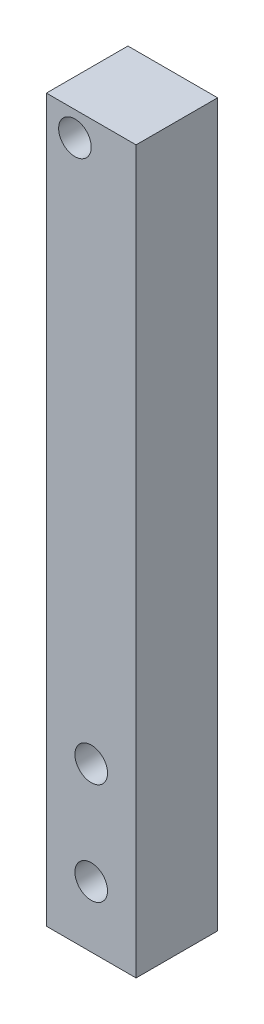
from build123d import *

# Parameters (mm, degrees)
SKETCH_4_R          = 4
EXTRUDE_3_DEPTH     = 20
CUT_EXTRUDE_1_REACH = 174.818
SKETCH_5_R          = 4


with BuildPart() as part:
    # 草图4 → 凸台-拉伸3 (new body)
    with BuildSketch(Plane.XY):
        Polygon((-7, 6), (15, 6), (15, -6), (15, -171), (-7, -171), (-7, -6), align=None)
        Circle(SKETCH_4_R, mode=Mode.SUBTRACT)
    extrude(amount=EXTRUDE_3_DEPTH)

    # 草图5 → 切除-拉伸1 (cut, up to next)
    with BuildSketch(Plane.XY.offset(20), mode=Mode.PRIVATE) as cut_extrude_1_sk1:
        with Locations((4, -131)):
            Circle(SKETCH_5_R)
    cut_extrude_1_tool1 = extrude(cut_extrude_1_sk1.sketch, amount=-CUT_EXTRUDE_1_REACH, mode=Mode.PRIVATE) & part.part
    # 草图5 → 切除-拉伸1 (cut, up to next)
    with BuildSketch(Plane.XY.offset(20), mode=Mode.PRIVATE) as cut_extrude_1_sk2:
        with Locations((4, -156)):
            Circle(SKETCH_5_R)
    cut_extrude_1_tool2 = extrude(cut_extrude_1_sk2.sketch, amount=-CUT_EXTRUDE_1_REACH, mode=Mode.PRIVATE) & part.part
    add(cut_extrude_1_tool1.solids().sort_by_distance((4, -131, 20))[0], mode=Mode.SUBTRACT)
    add(cut_extrude_1_tool2.solids().sort_by_distance((4, -156, 20))[0], mode=Mode.SUBTRACT)


solid = part.part
